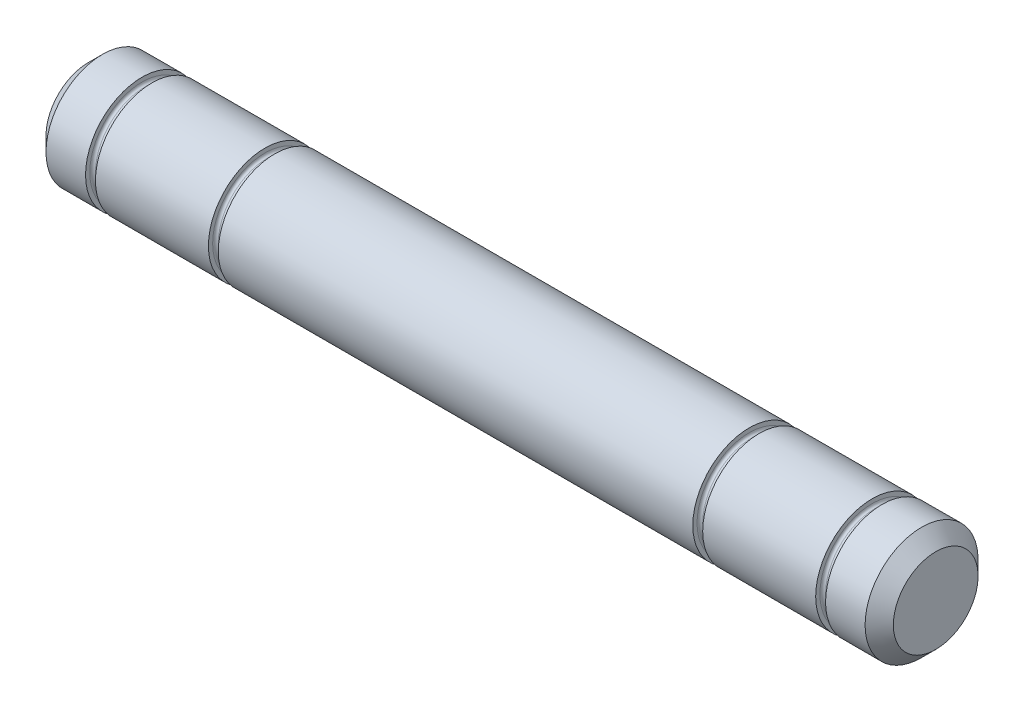
from build123d import *

# Parameters (mm, degrees)
SKETCH1_W     = 60
SKETCH1_H     = 4
CHAMFER1_SIZE = 1


with BuildPart() as part:
    # Sketch1 → Revolve1 (revolve)
    with BuildSketch(Plane.XY, mode=Mode.PRIVATE) as revolve1_sk:
        with Locations((0, 2)):
            Rectangle(SKETCH1_W, SKETCH1_H)
    revolve(revolve1_sk.sketch.rotate(Axis((-30, 0, 0), (1, 0, 0)), 90), axis=Axis((-30, 0, 0), (1, 0, 0)))

    # Chamfer1
    chamfer1_edges = [part.edges().sort_by_distance(p)[0] for p in [
        (-30, 0, -4),
        (30, 0, -4),
    ]]
    chamfer(chamfer1_edges, length=CHAMFER1_SIZE)

    # Sketch2 → Cut-Revolve1 (revolve, cut)
    with BuildSketch(Plane(origin=(0, 0, 0), x_dir=(1, 0, 0), z_dir=(0, 1, 0))):
        with BuildLine():
            Line((25.7, -3.5), (26, -3.5))
            ThreePointArc((26, -3.5), (26.141421356, -3.558578644), (26.2, -3.7))
            Line((26.2, -3.7), (26.2, -4.8))
            Line((26.2, -4.8), (25.5, -4.8))
            Line((25.5, -4.8), (25.5, -3.7))
            ThreePointArc((25.5, -3.7), (25.558578644, -3.558578644), (25.7, -3.5))
        make_face()
        with BuildLine():
            Line((17, -3.5), (17.3, -3.5))
            ThreePointArc((17.3, -3.5), (17.441421356, -3.558578644), (17.5, -3.7))
            Line((17.5, -3.7), (17.5, -4.8))
            Line((17.5, -4.8), (16.8, -4.8))
            Line((16.8, -4.8), (16.8, -3.7))
            ThreePointArc((16.8, -3.7), (16.858578644, -3.558578644), (17, -3.5))
        make_face()
    cut_revolve1 = revolve(axis=Axis((0, 0, 0), (1, 0, 0)), mode=Mode.SUBTRACT)

    # Mirror1: Cut-Revolve1 across plane
    add(cut_revolve1.mirror(Plane(origin=(0, 0, 0), x_dir=(0, 0, 1), z_dir=(1, 0, 0))), mode=Mode.SUBTRACT)


solid = part.part
